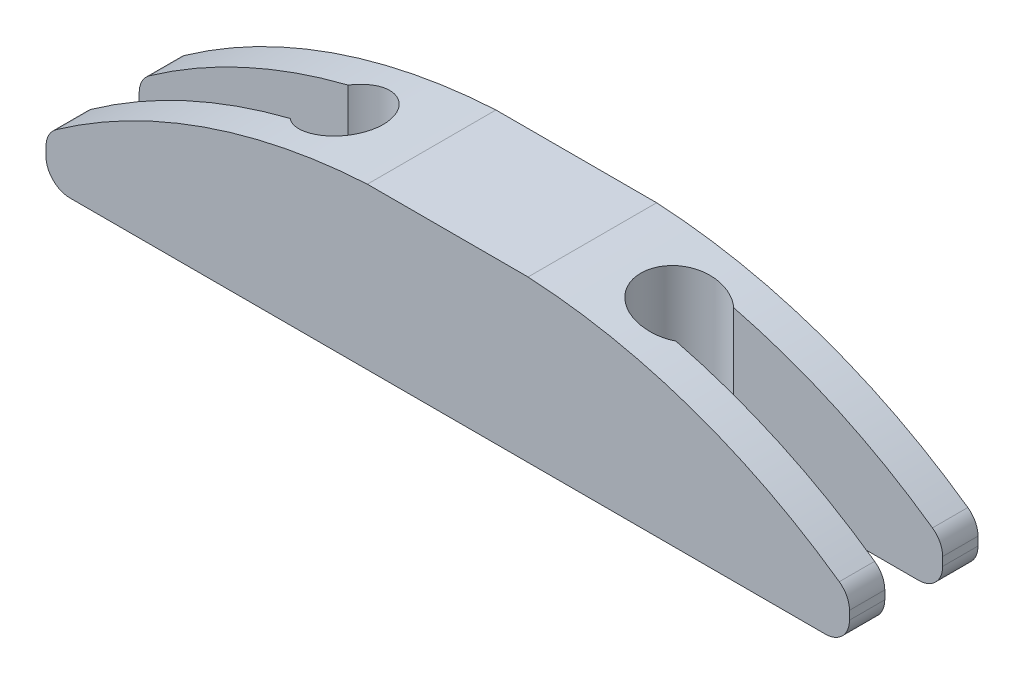
from build123d import *

# Parameters (mm, degrees)
BOSS_EXTRUDE1_DEPTH      = 20
BOSS_EXTRUDE1_DEPTH_BACK = 20
FILLET4_R                = 7.5
FILLET5_R                = 7.5
FILLET6_R                = 7.5
FILLET7_R                = 7.5
CUT_EXTRUDE6_DEPTH       = 137.106575888


with BuildPart() as part:
    # Sketch1 → Boss-Extrude1 (new, two sides: drawn at the far end of the back side and taken through both)
    with BuildSketch(Plane.XY.offset(-BOSS_EXTRUDE1_DEPTH_BACK)):
        with BuildLine():
            Line((125, 0), (-125, 0))
            Line((-125, 0), (-125, 14))
            ThreePointArc((-125, 14), (-77.640903187, 39.335842187), (-25, 50))
            Line((-25, 50), (25, 50))
            ThreePointArc((25, 50), (77.640903187, 39.335842187), (125, 14))
            Line((125, 14), (125, 0))
        make_face()
    extrude(amount=BOSS_EXTRUDE1_DEPTH + BOSS_EXTRUDE1_DEPTH_BACK)

    # Fillet4
    fillet4_edges = [part.edges().sort_by_distance(p)[0] for p in [
        (-125, 14, 0),
    ]]
    fillet(fillet4_edges, radius=FILLET4_R)

    # Fillet5
    fillet5_edges = [part.edges().sort_by_distance(p)[0] for p in [
        (125, 14, 0),
    ]]
    fillet(fillet5_edges, radius=FILLET5_R)

    # Fillet6
    fillet6_edges = [part.edges().sort_by_distance(p)[0] for p in [
        (125, 0, 0),
    ]]
    fillet(fillet6_edges, radius=FILLET6_R)

    # Fillet7
    fillet7_edges = [part.edges().sort_by_distance(p)[0] for p in [
        (-125, 0, 0),
    ]]
    fillet(fillet7_edges, radius=FILLET7_R)

    # Sketch3 → Cut-Extrude6 (cut, through all)
    with BuildSketch(Plane(origin=(0, 0, 0), x_dir=(1, 0, 0), z_dir=(0, 1, 0))):
        with BuildLine():
            Line((-59.997253933, 9), (-125, 9))
            Line((-125, 9), (-125, -9))
            Line((-125, -9), (-59.997253933, -9))
            ThreePointArc((-59.997253933, -9), (-40.06, 0), (-59.997253933, 9))
        make_face()
        with BuildLine():
            Line((59.997253933, -9), (125, -9))
            Line((125, -9), (125, 9))
            Line((125, 9), (59.997253933, 9))
            ThreePointArc((59.997253933, 9), (40.06, 0), (59.997253933, -9))
        make_face()
    extrude(amount=CUT_EXTRUDE6_DEPTH, mode=Mode.SUBTRACT)


solid = part.part
